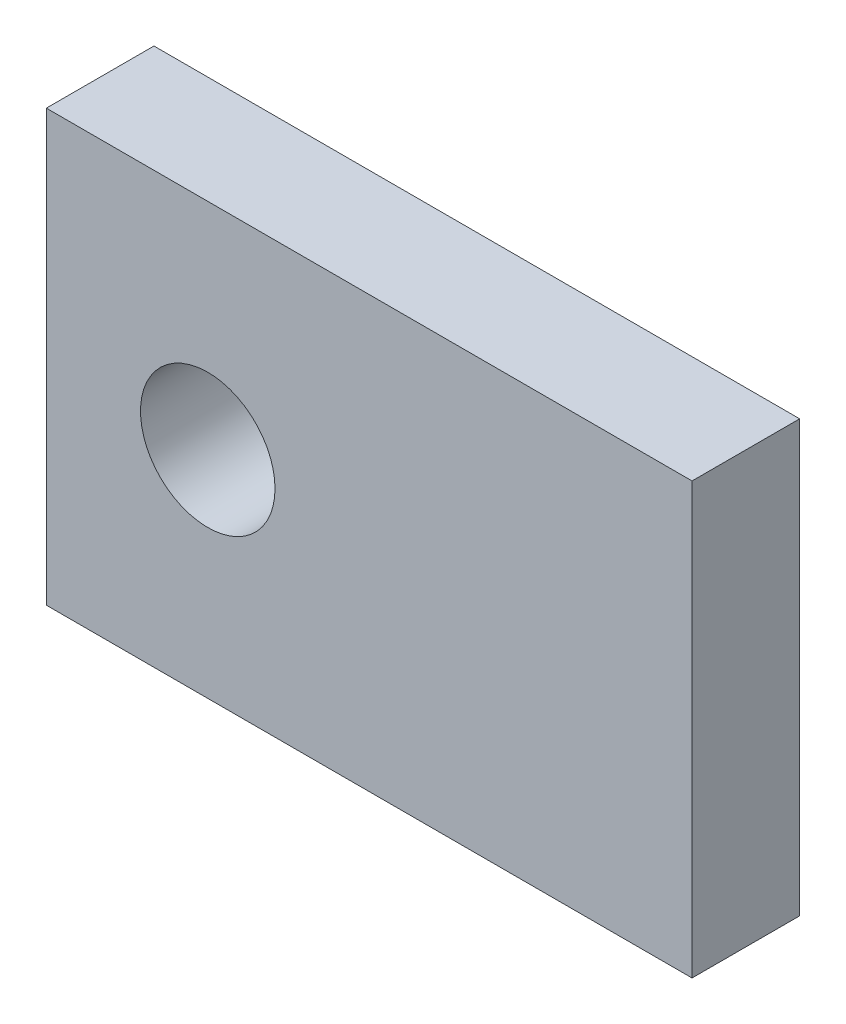
from build123d import *

# Parameters (mm, degrees)
SKETCH1_W           = 38.1
SKETCH1_H           = 25.4
BOSS_EXTRUDE1_DEPTH = 6.35
SKETCH2_R           = 3.96875
CUT_EXTRUDE1_DEPTH  = 24.759524406


with BuildPart() as part:
    # Sketch1 → Boss-Extrude1 (new body)
    with BuildSketch(Plane.XY):
        Rectangle(SKETCH1_W, SKETCH1_H)
    extrude(amount=BOSS_EXTRUDE1_DEPTH)

    # Sketch2 → Cut-Extrude1 (cut, through all)
    with BuildSketch(Plane.XY.offset(6.35)):
        with Locations((-9.525, 0)):
            Circle(SKETCH2_R)
    extrude(amount=-CUT_EXTRUDE1_DEPTH, mode=Mode.SUBTRACT)


solid = part.part
